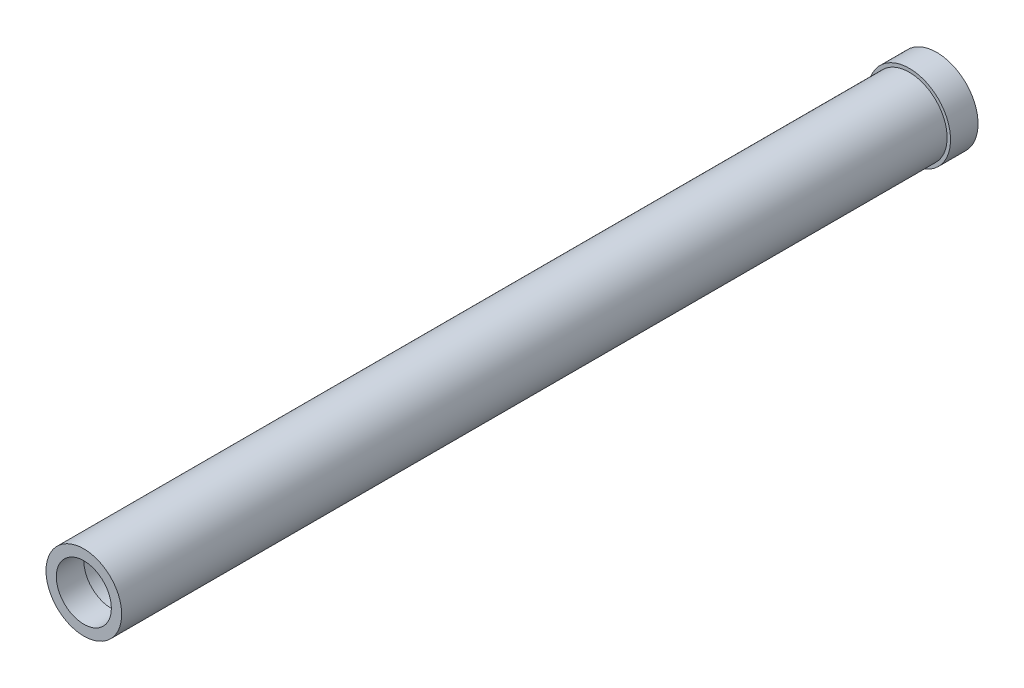
from build123d import *

# Parameters (mm, degrees)
SKETCH1_R           = 3.4925
SKETCH1_R_2         = 2.8575
BOSS_EXTRUDE1_DEPTH = 76.2
SKETCH2_R           = 3.4925
SKETCH2_R_2         = 2.54
BOSS_EXTRUDE2_DEPTH = 2.54
SKETCH3_R           = 3.81
SKETCH3_R_2         = 3.4925
BOSS_EXTRUDE3_DEPTH = 2.54


with BuildPart() as part:
    # Sketch1 → Boss-Extrude1 (new body)
    with BuildSketch(Plane.XY):
        with Locations(Location((0, 0, 0), (0, 0, 180))):
            Circle(SKETCH1_R)
        with Locations(Location((0, 0, 0), (0, 0, 180))):
            Circle(SKETCH1_R_2, mode=Mode.SUBTRACT)
    extrude(amount=BOSS_EXTRUDE1_DEPTH)

    # Sketch2 → Boss-Extrude2 (add)
    with BuildSketch(Plane.XY.offset(76.2)):
        with Locations(Location((0, 0, 0), (0, 0, 180))):
            Circle(SKETCH2_R)
        Circle(SKETCH2_R_2, mode=Mode.SUBTRACT)
    extrude(amount=BOSS_EXTRUDE2_DEPTH)

    # Sketch3 → Boss-Extrude3 (add)
    with BuildSketch(Plane(origin=(0, 0, 0), x_dir=(-1, 0, 0), z_dir=(0, 0, -1))):
        Circle(SKETCH3_R)
        Circle(SKETCH3_R_2, mode=Mode.SUBTRACT)
    extrude(amount=-BOSS_EXTRUDE3_DEPTH)


solid = part.part
